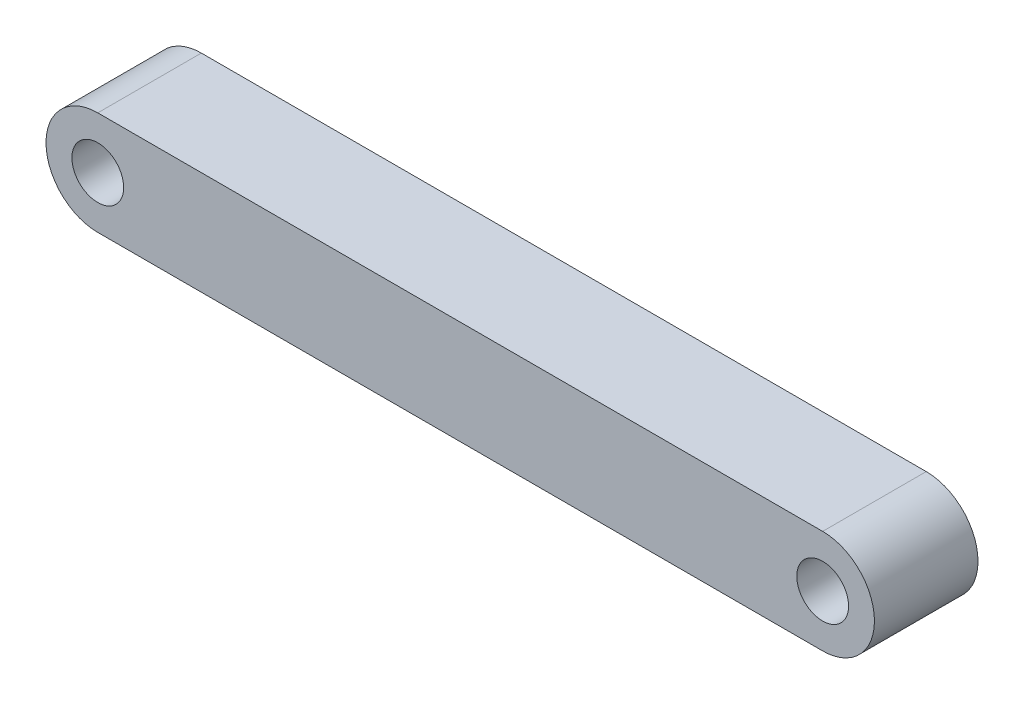
from build123d import *

# Parameters (mm, degrees)
SKETCH1_R           = 1.5
BOSS_EXTRUDE1_DEPTH = 6


with BuildPart() as part:
    # Sketch1 → Boss-Extrude1 (new body)
    with BuildSketch(Plane.XY):
        with BuildLine():
            Line((0, 0), (42, 0))
            ThreePointArc((42, 0), (45, 3), (42, 6))
            Line((42, 6), (0, 6))
            ThreePointArc((0, 6), (-3, 3), (0, 0))
        make_face()
        with Locations((0, 3)):
            Circle(SKETCH1_R, mode=Mode.SUBTRACT)
        with Locations((42, 3)):
            Circle(SKETCH1_R, mode=Mode.SUBTRACT)
    extrude(amount=BOSS_EXTRUDE1_DEPTH)


solid = part.part
